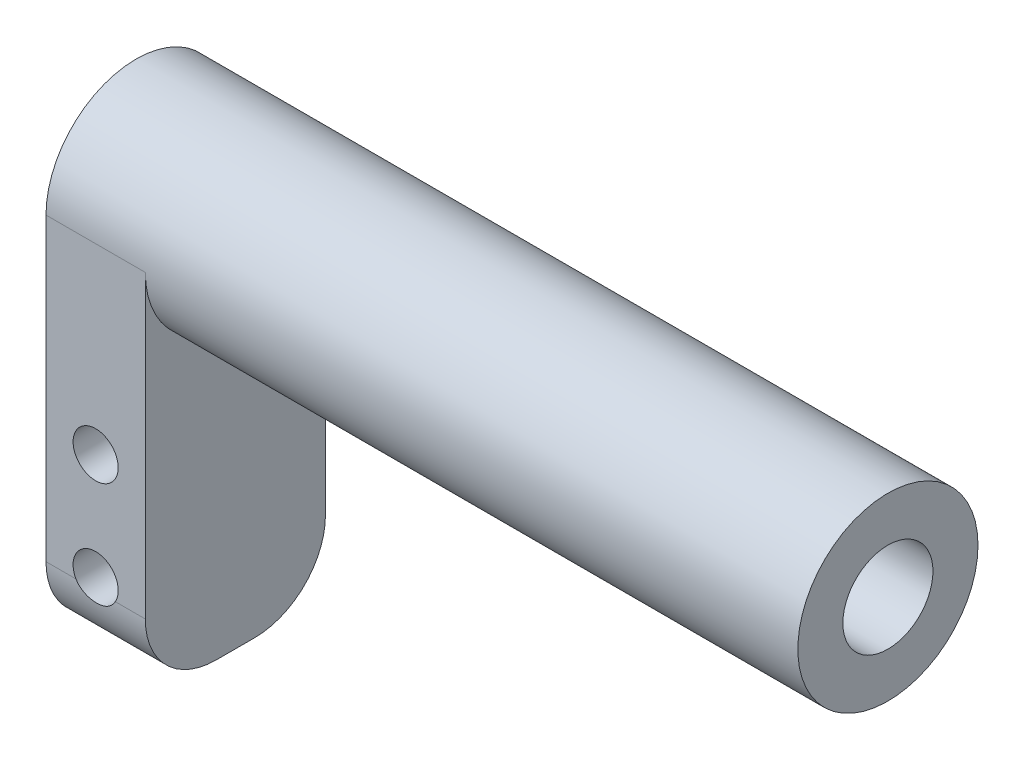
from build123d import *

# Parameters (mm, degrees)
SKETCH1_R           = 6.35
SKETCH1_R_2         = 3.175
BOSS_EXTRUDE1_DEPTH = 53
SKETCH1_3_R         = 3.175
SKETCH1_3_R_2       = 3
BOSS_EXTRUDE2_DEPTH = 7
BOSS_EXTRUDE3_DEPTH = 7
FILLET2_R           = 5
SKETCH11_R          = 1.59
CUT_EXTRUDE5_DEPTH  = 61.453582193
CUT_EXTRUDE6_DEPTH  = 15


with BuildPart() as part:
    # Sketch1 → Boss-Extrude1 (new body)
    with BuildSketch(Plane.YZ):
        Circle(SKETCH1_R)
        Circle(SKETCH1_R_2, mode=Mode.SUBTRACT)
    extrude(amount=BOSS_EXTRUDE1_DEPTH)

    # Sketch1<3> → Boss-Extrude2 (add)
    with BuildSketch(Plane.YZ):
        Circle(SKETCH1_3_R)
        Circle(SKETCH1_3_R_2, mode=Mode.SUBTRACT)
    extrude(amount=BOSS_EXTRUDE2_DEPTH)

    # Sketch10 → Boss-Extrude3 (add)
    with BuildSketch(Plane(origin=(0, 0, 0), x_dir=(0, -1, 0), z_dir=(-1, 0, 0))):
        with BuildLine():
            Line((26.16, 6.35), (0, 6.35))
            ThreePointArc((0, 6.35), (6.35, 0), (0, -6.35))
            Line((0, -6.35), (26.16, -6.35))
            Line((26.16, -6.35), (26.16, 6.35))
        make_face()
    extrude(amount=-BOSS_EXTRUDE3_DEPTH)

    # Fillet2
    fillet2_edges = [part.edges().sort_by_distance(p)[0] for p in [
        (3.5, -26.16, 6.35),
        (3.5, -26.16, -6.35),
    ]]
    fillet(fillet2_edges, radius=FILLET2_R)

    # Sketch11 → Cut-Extrude5 (cut, through all)
    with BuildSketch(Plane(origin=(0, 0, -6.35), x_dir=(1, 0, 0), z_dir=(0, 0, -1))):
        with Locations((3.5, 20.38)):
            Circle(SKETCH11_R)
        with Locations((3.5, 12.88)):
            Circle(SKETCH11_R)
    extrude(amount=-CUT_EXTRUDE5_DEPTH, mode=Mode.SUBTRACT)

    # Sketch14 → Cut-Extrude6 (cut)
    with BuildSketch(Plane.ZY):
        with BuildLine():
            Line((0.394195268, -3.844294872), (0.511152831, -3.259062998))
            ThreePointArc((0.511152831, -3.259062998), (0.551737931, -3.219580053), (0.603153546, -3.243296878))
            Line((0.603153546, -3.243296878), (0.90829688, -3.756193519))
            ThreePointArc((0.90829688, -3.756193519), (0.932155167, -3.776831916), (0.963621249, -3.779078471))
            ThreePointArc((0.963621249, -3.779078471), (1.132224679, -3.732032593), (1.298547251, -3.677468564))
            Line((1.298547251, -3.677468564), (1.333878559, -3.664801221))
            ThreePointArc((1.333878559, -3.664801221), (1.496981223, -3.601256339), (1.65706823, -3.530456752))
            ThreePointArc((1.65706823, -3.530456752), (1.679938755, -3.50872888), (1.685248668, -3.477632801))
            Line((1.685248668, -3.477632801), (1.594991737, -2.887692885))
            ThreePointArc((1.594991737, -2.887692885), (1.619625293, -2.836710131), (1.676051799, -2.841411481))
            Line((1.676051799, -2.841411481), (2.138213721, -3.219011503))
            ThreePointArc((2.138213721, -3.219011503), (2.167691925, -3.230245238), (2.198028737, -3.221594275))
            ThreePointArc((2.198028737, -3.221594275), (2.340373498, -3.119719841), (2.478003595, -3.011560756))
            Line((2.478003595, -3.011560756), (2.506871678, -2.987573328))
            ThreePointArc((2.506871678, -2.987573328), (2.638404418, -2.872076274), (2.764622113, -2.750793444))
            ThreePointArc((2.764622113, -2.750793444), (2.778682006, -2.722553743), (2.773036206, -2.69151689))
            Line((2.773036206, -2.69151689), (2.4864511, -2.168024393))
            ThreePointArc((2.4864511, -2.168024393), (2.492161942, -2.111691103), (2.54679347, -2.096809925))
            Line((2.54679347, -2.096809925), (3.110230431, -2.293569192))
            ThreePointArc((3.110230431, -2.293569192), (3.141773045, -2.29404331), (3.16732152, -2.275538263))
            ThreePointArc((3.16732152, -2.275538263), (3.266238734, -2.131122834), (3.358576134, -1.982414274))
            Line((3.358576134, -1.982414274), (3.377499075, -1.95))
            ThreePointArc((3.377499075, -1.95), (3.461597101, -1.796481424), (3.538721767, -1.63934385))
            ThreePointArc((3.538721767, -1.63934385), (3.542275198, -1.607998444), (3.526354653, -1.58076432))
            Line((3.526354653, -1.58076432), (3.078007764, -1.186860162))
            ThreePointArc((3.078007764, -1.186860162), (3.06410708, -1.131970962), (3.110354261, -1.099302146))
            Line((3.110354261, -1.099302146), (3.707107449, -1.091488587))
            ThreePointArc((3.707107449, -1.091488587), (3.736909969, -1.081145903), (3.754588583, -1.055018754))
            ThreePointArc((3.754588583, -1.055018754), (3.798147373, -0.885480962), (3.834054823, -0.714159374))
            Line((3.834054823, -0.714159374), (3.840750237, -0.677227893))
            ThreePointArc((3.840750237, -0.677227893), (3.867270087, -0.504204401), (3.88599935, -0.330165193))
            ThreePointArc((3.88599935, -0.330165193), (3.878617723, -0.299494801), (3.854342685, -0.279348243))
            Line((3.854342685, -0.279348243), (3.298311265, -0.062543079))
            ThreePointArc((3.298311265, -0.062543079), (3.266475683, -0.015718417), (3.298760425, 0.030797696))
            Line((3.298760425, 0.030797696), (3.856852597, 0.24224165))
            ThreePointArc((3.856852597, 0.24224165), (3.881320399, 0.262153656), (3.888996851, 0.292751587))
            ThreePointArc((3.888996851, 0.292751587), (3.871943384, 0.466962983), (3.847089917, 0.640233686))
            Line((3.847089917, 0.640233686), (3.840750237, 0.677227893))
            ThreePointArc((3.840750237, 0.677227893), (3.806493224, 0.848887114), (3.76456806, 1.018836259))
            ThreePointArc((3.76456806, 1.018836259), (3.747141708, 1.045132335), (3.717440105, 1.055761355))
            Line((3.717440105, 1.055761355), (3.12078975, 1.069317621))
            ThreePointArc((3.12078975, 1.069317621), (3.074859111, 1.102430001), (3.089287397, 1.157182881))
            Line((3.089287397, 1.157182881), (3.541404401, 1.546753969))
            ThreePointArc((3.541404401, 1.546753969), (3.557586307, 1.573833615), (3.554334703, 1.605211767))
            ThreePointArc((3.554334703, 1.605211767), (3.47872588, 1.763084301), (3.396109189, 1.917405115))
            Line((3.396109189, 1.917405115), (3.377499075, 1.95))
            ThreePointArc((3.377499075, 1.95), (3.286597101, 2.099590315), (3.189074303, 2.244951022))
            ThreePointArc((3.189074303, 2.244951022), (3.163705101, 2.263701087), (3.132159385, 2.263530552))
            Line((3.132159385, 2.263530552), (2.566854933, 2.072202836))
            ThreePointArc((2.566854933, 2.072202836), (2.51236915, 2.087609091), (2.507200715, 2.143994732))
            Line((2.507200715, 2.143994732), (2.798810569, 2.664704931))
            ThreePointArc((2.798810569, 2.664704931), (2.804754802, 2.695686013), (2.790967334, 2.724059717))
            ThreePointArc((2.790967334, 2.724059717), (2.665922694, 2.846551631), (2.535507572, 2.963309189))
            Line((2.535507572, 2.963309189), (2.506871678, 2.987573328))
            ThreePointArc((2.506871678, 2.987573328), (2.370288863, 3.097051938), (2.228931119, 3.200291559))
            ThreePointArc((2.228931119, 3.200291559), (2.198678968, 3.209234079), (2.169094017, 3.198284558))
            Line((2.169094017, 3.198284558), (1.703319528, 2.825149805))
            ThreePointArc((1.703319528, 2.825149805), (1.64685039, 2.820991714), (1.622708626, 2.872209177))
            Line((1.622708626, 2.872209177), (1.718638876, 3.461253152))
            ThreePointArc((1.718638876, 3.461253152), (1.713628474, 3.492398894), (1.690968114, 3.514345862))
            ThreePointArc((1.690968114, 3.514345862), (1.531569886, 3.586682825), (1.369086322, 3.651794441))
            Line((1.369086322, 3.651794441), (1.333878559, 3.664801221))
            ThreePointArc((1.333878559, 3.664801221), (1.168088806, 3.720963389), (0.999945947, 3.769629704))
            ThreePointArc((0.999945947, 3.769629704), (0.968459702, 3.767686078), (0.944403898, 3.747278245))
            Line((0.944403898, 3.747278245), (0.63433865, 3.237342014))
            ThreePointArc((0.63433865, 3.237342014), (0.582697169, 3.214121104), (0.542493927, 3.253992805))
            Line((0.542493927, 3.253992805), (0.43117397, 3.840323161))
            ThreePointArc((0.43117397, 3.840323161), (0.415813261, 3.867876925), (0.387013183, 3.88075003))
            ThreePointArc((0.387013183, 3.88075003), (0.212487146, 3.894207135), (0.037533056, 3.899819389))
            Line((0.037533056, 3.899819389), (0, 3.9))
            ThreePointArc((0, 3.9), (-0.175, 3.89607174), (-0.349647464, 3.884294872))
            ThreePointArc((-0.349647464, 3.884294872), (-0.378570097, 3.871699531), (-0.394195268, 3.844294872))
            Line((-0.394195268, 3.844294872), (-0.511152831, 3.259062998))
            ThreePointArc((-0.511152831, 3.259062998), (-0.551737931, 3.219580053), (-0.603153546, 3.243296878))
            Line((-0.603153546, 3.243296878), (-0.90829688, 3.756193519))
            ThreePointArc((-0.90829688, 3.756193519), (-0.932155167, 3.776831916), (-0.963621249, 3.779078471))
            ThreePointArc((-0.963621249, 3.779078471), (-1.132224679, 3.732032593), (-1.298547251, 3.677468564))
            Line((-1.298547251, 3.677468564), (-1.333878559, 3.664801221))
            ThreePointArc((-1.333878559, 3.664801221), (-1.496981223, 3.601256339), (-1.65706823, 3.530456752))
            ThreePointArc((-1.65706823, 3.530456752), (-1.679938755, 3.50872888), (-1.685248668, 3.477632801))
            Line((-1.685248668, 3.477632801), (-1.594991737, 2.887692885))
            ThreePointArc((-1.594991737, 2.887692885), (-1.619625293, 2.836710131), (-1.676051799, 2.841411481))
            Line((-1.676051799, 2.841411481), (-2.138213721, 3.219011503))
            ThreePointArc((-2.138213721, 3.219011503), (-2.167691925, 3.230245238), (-2.198028737, 3.221594275))
            ThreePointArc((-2.198028737, 3.221594275), (-2.340373498, 3.119719841), (-2.478003595, 3.011560756))
            Line((-2.478003595, 3.011560756), (-2.506871678, 2.987573328))
            ThreePointArc((-2.506871678, 2.987573328), (-2.638404418, 2.872076274), (-2.764622113, 2.750793444))
            ThreePointArc((-2.764622113, 2.750793444), (-2.778682006, 2.722553743), (-2.773036206, 2.69151689))
            Line((-2.773036206, 2.69151689), (-2.4864511, 2.168024393))
            ThreePointArc((-2.4864511, 2.168024393), (-2.492161942, 2.111691103), (-2.54679347, 2.096809925))
            Line((-2.54679347, 2.096809925), (-3.110230431, 2.293569192))
            ThreePointArc((-3.110230431, 2.293569192), (-3.141773045, 2.29404331), (-3.16732152, 2.275538263))
            ThreePointArc((-3.16732152, 2.275538263), (-3.266238734, 2.131122834), (-3.358576134, 1.982414274))
            Line((-3.358576134, 1.982414274), (-3.377499075, 1.95))
            ThreePointArc((-3.377499075, 1.95), (-3.461597101, 1.796481424), (-3.538721767, 1.63934385))
            ThreePointArc((-3.538721767, 1.63934385), (-3.542275198, 1.607998444), (-3.526354653, 1.58076432))
            Line((-3.526354653, 1.58076432), (-3.078007764, 1.186860162))
            ThreePointArc((-3.078007764, 1.186860162), (-3.06410708, 1.131970962), (-3.110354261, 1.099302146))
            Line((-3.110354261, 1.099302146), (-3.707107449, 1.091488587))
            ThreePointArc((-3.707107449, 1.091488587), (-3.736909969, 1.081145903), (-3.754588583, 1.055018754))
            ThreePointArc((-3.754588583, 1.055018754), (-3.798147373, 0.885480962), (-3.834054823, 0.714159374))
            Line((-3.834054823, 0.714159374), (-3.840750237, 0.677227893))
            ThreePointArc((-3.840750237, 0.677227893), (-3.867270087, 0.504204401), (-3.88599935, 0.330165193))
            ThreePointArc((-3.88599935, 0.330165193), (-3.878617723, 0.299494801), (-3.854342685, 0.279348243))
            Line((-3.854342685, 0.279348243), (-3.298311265, 0.062543079))
            ThreePointArc((-3.298311265, 0.062543079), (-3.266475683, 0.015718417), (-3.298760425, -0.030797696))
            Line((-3.298760425, -0.030797696), (-3.856852597, -0.24224165))
            ThreePointArc((-3.856852597, -0.24224165), (-3.881320399, -0.262153656), (-3.888996851, -0.292751587))
            ThreePointArc((-3.888996851, -0.292751587), (-3.871943384, -0.466962983), (-3.847089917, -0.640233686))
            Line((-3.847089917, -0.640233686), (-3.840750237, -0.677227893))
            ThreePointArc((-3.840750237, -0.677227893), (-3.806493224, -0.848887114), (-3.76456806, -1.018836259))
            ThreePointArc((-3.76456806, -1.018836259), (-3.747141708, -1.045132335), (-3.717440105, -1.055761355))
            Line((-3.717440105, -1.055761355), (-3.12078975, -1.069317621))
            ThreePointArc((-3.12078975, -1.069317621), (-3.074859111, -1.102430001), (-3.089287397, -1.157182881))
            Line((-3.089287397, -1.157182881), (-3.541404401, -1.546753969))
            ThreePointArc((-3.541404401, -1.546753969), (-3.557586307, -1.573833615), (-3.554334703, -1.605211767))
            ThreePointArc((-3.554334703, -1.605211767), (-3.47872588, -1.763084301), (-3.396109189, -1.917405115))
            Line((-3.396109189, -1.917405115), (-3.377499075, -1.95))
            ThreePointArc((-3.377499075, -1.95), (-3.286597101, -2.099590315), (-3.189074303, -2.244951022))
            ThreePointArc((-3.189074303, -2.244951022), (-3.163705101, -2.263701087), (-3.132159385, -2.263530552))
            Line((-3.132159385, -2.263530552), (-2.566854933, -2.072202836))
            ThreePointArc((-2.566854933, -2.072202836), (-2.51236915, -2.087609091), (-2.507200715, -2.143994732))
            Line((-2.507200715, -2.143994732), (-2.798810569, -2.664704931))
            ThreePointArc((-2.798810569, -2.664704931), (-2.804754802, -2.695686013), (-2.790967334, -2.724059717))
            ThreePointArc((-2.790967334, -2.724059717), (-2.665922694, -2.846551631), (-2.535507572, -2.963309189))
            Line((-2.535507572, -2.963309189), (-2.506871678, -2.987573328))
            ThreePointArc((-2.506871678, -2.987573328), (-2.370288863, -3.097051938), (-2.228931119, -3.200291559))
            ThreePointArc((-2.228931119, -3.200291559), (-2.198678968, -3.209234079), (-2.169094017, -3.198284558))
            Line((-2.169094017, -3.198284558), (-1.703319528, -2.825149805))
            ThreePointArc((-1.703319528, -2.825149805), (-1.64685039, -2.820991714), (-1.622708626, -2.872209177))
            Line((-1.622708626, -2.872209177), (-1.718638876, -3.461253152))
            ThreePointArc((-1.718638876, -3.461253152), (-1.713628474, -3.492398894), (-1.690968114, -3.514345862))
            ThreePointArc((-1.690968114, -3.514345862), (-1.531569886, -3.586682825), (-1.369086322, -3.651794441))
            Line((-1.369086322, -3.651794441), (-1.333878559, -3.664801221))
            ThreePointArc((-1.333878559, -3.664801221), (-1.168088806, -3.720963389), (-0.999945947, -3.769629704))
            ThreePointArc((-0.999945947, -3.769629704), (-0.968459702, -3.767686078), (-0.944403898, -3.747278245))
            Line((-0.944403898, -3.747278245), (-0.63433865, -3.237342014))
            ThreePointArc((-0.63433865, -3.237342014), (-0.582697169, -3.214121104), (-0.542493927, -3.253992805))
            Line((-0.542493927, -3.253992805), (-0.43117397, -3.840323161))
            ThreePointArc((-0.43117397, -3.840323161), (-0.415813261, -3.867876925), (-0.387013183, -3.88075003))
            ThreePointArc((-0.387013183, -3.88075003), (-0.212487146, -3.894207135), (-0.037533056, -3.899819389))
            Line((-0.037533056, -3.899819389), (0, -3.9))
            ThreePointArc((0, -3.9), (0.175, -3.89607174), (0.349647464, -3.884294872))
            ThreePointArc((0.349647464, -3.884294872), (0.378570097, -3.871699531), (0.394195268, -3.844294872))
        make_face()
    extrude(amount=-CUT_EXTRUDE6_DEPTH, mode=Mode.SUBTRACT)


solid = part.part
